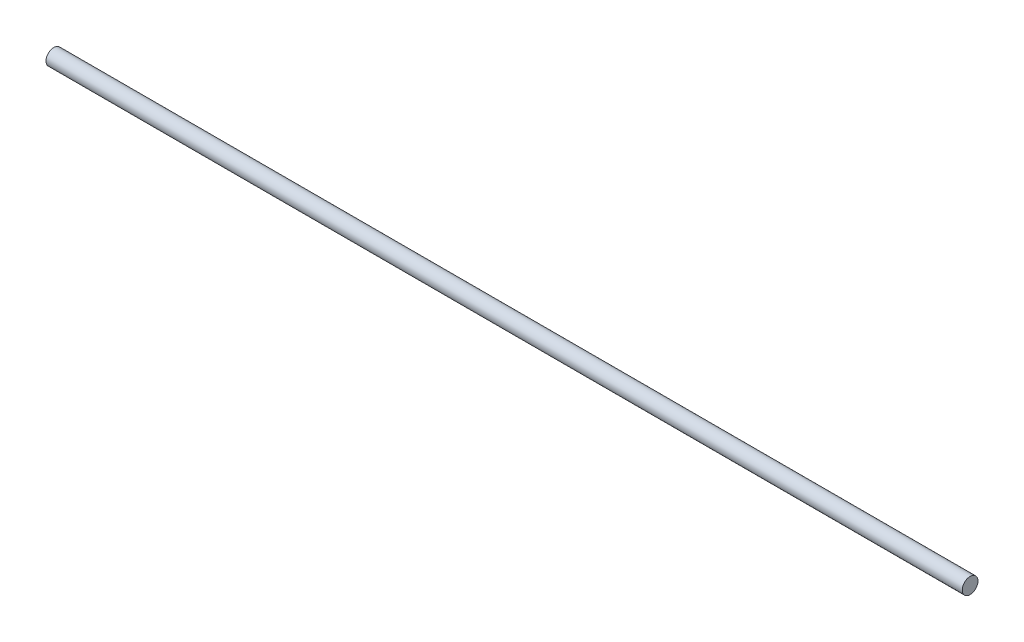
from build123d import *

# Parameters (mm, degrees)
SKETCH1_R           = 4
BOSS_EXTRUDE1_DEPTH = 465


with BuildPart() as part:
    # Sketch1 → Boss-Extrude1 (new body)
    with BuildSketch(Plane(origin=(0, 0, 0), x_dir=(0, 0, -1), z_dir=(1, 0, 0))):
        Circle(SKETCH1_R)
    extrude(amount=BOSS_EXTRUDE1_DEPTH)


solid = part.part
